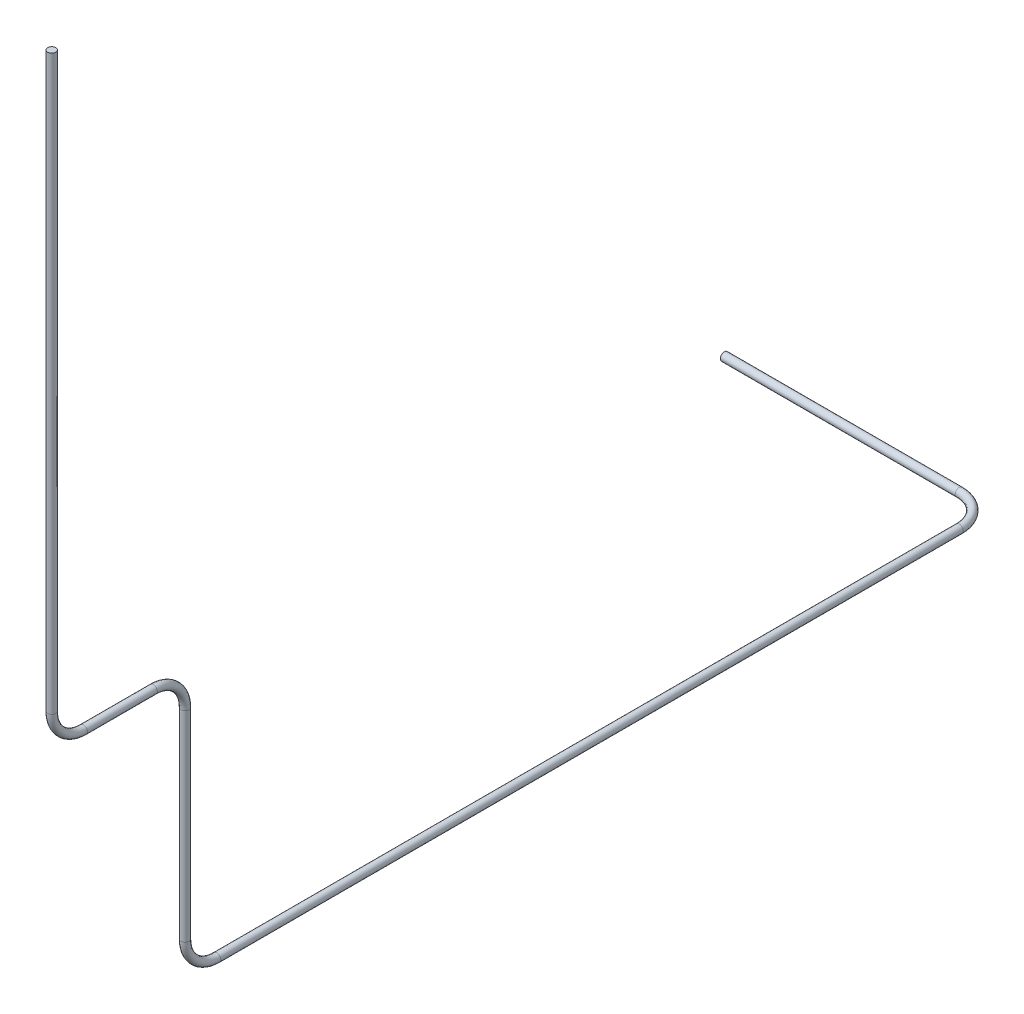
from build123d import *

# Parameters (mm, degrees)
BARRER2_PROFILE_R = 6.35


with BuildPart() as part:
    # Barrer2: sweep along a curve in space
    with BuildLine() as barrer2_path:
        Line((656.377216768, -1278.810695772, 2027.32), (1026.377216768, -1278.810695772, 2027.32))
        ThreePointArc((1026.377216768, -1278.810695772, 2027.32), (1061.732555827, -1278.810695772, 2041.964660941), (1076.377216768, -1278.810695772, 2077.32))
        Line((1076.377216768, -1278.810695772, 2077.32), (1076.377216768, -1278.810695772, 3246.879646339))
        ThreePointArc((1076.377216768, -1278.810695772, 3246.879646339), (1076.377216768, -1264.166034831, 3282.234985398), (1076.377216768, -1228.810695772, 3296.879646339))
        Line((1076.377216768, -1228.810695772, 3296.879646339), (1076.377216768, -912.884720839, 3296.879646339))
        ThreePointArc((1076.377216768, -912.884720839, 3296.879646339), (1076.377216768, -877.52938178, 3311.524307279), (1076.377216768, -862.884720839, 3346.879646339))
        Line((1076.377216768, -862.884720839, 3346.879646339), (1076.377216768, -862.884720839, 3456.879646339))
        ThreePointArc((1076.377216768, -862.884720839, 3456.879646339), (1076.377216768, -848.240059899, 3492.234985398), (1076.377216768, -812.884720839, 3506.879646339))
        Line((1076.377216768, -812.884720839, 3506.879646339), (1076.377216768, 89.041385613, 3506.879646339))
    # Barrer2 profile (on start of the path) → Barrer2 (sweep)
    with BuildSketch(Plane(origin=(656.377216768, -1278.810695772, 2027.32), x_dir=(0, 0, 1), z_dir=(1, 0, 0))):
        Circle(BARRER2_PROFILE_R)
    sweep(path=barrer2_path.line)


solid = part.part
